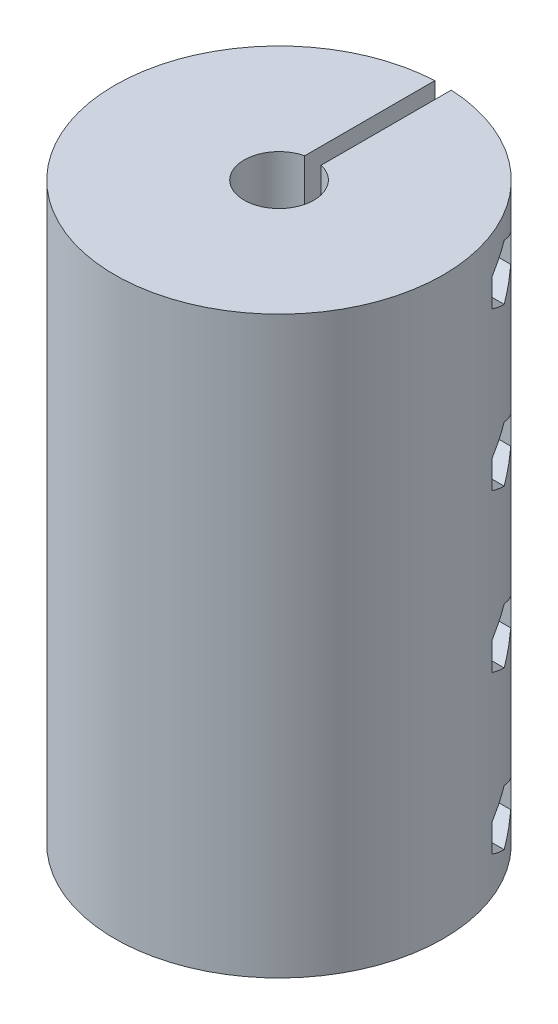
from build123d import *

# Parameters (mm, degrees)
SKETCH1_R           = 20
SKETCH1_R_2         = 4.25
BOSS_EXTRUDE1_DEPTH = 35
SKETCH2_W           = 2
SKETCH2_H           = 25
CUT_EXTRUDE1_DEPTH  = 35
SKETCH4_R           = 1.75
CUT_EXTRUDE2_DEPTH  = 30
CUT_EXTRUDE3_DEPTH  = 11
SKETCH6_R           = 3
CUT_EXTRUDE4_DEPTH  = 11


with BuildPart() as part:
    # Sketch1 → Boss-Extrude1 (new, symmetric)
    with BuildSketch(Plane(origin=(0, 0, 0), x_dir=(1, 0, 0), z_dir=(0, 1, 0))):
        with Locations(Location((0, 0, 0), (0, 0, 270))):
            Circle(SKETCH1_R)
        with Locations(Location((0, 0, 0), (0, 0, 270))):
            Circle(SKETCH1_R_2, mode=Mode.SUBTRACT)
    extrude(amount=BOSS_EXTRUDE1_DEPTH, both=True)

    # Sketch2 → Cut-Extrude1 (cut, symmetric)
    with BuildSketch(Plane(origin=(0, 0, 0), x_dir=(1, 0, 0), z_dir=(0, 1, 0))):
        with Locations((0, 12.5)):
            Rectangle(SKETCH2_W, SKETCH2_H)
    extrude(amount=CUT_EXTRUDE1_DEPTH, both=True, mode=Mode.SUBTRACT)

    # Sketch4 → Cut-Extrude2 (cut)
    with BuildSketch(Plane(origin=(20, 0, 0), x_dir=(0, 0, -1), z_dir=(1, 0, 0))):
        with Locations((10.231687805, 28.75)):
            Circle(SKETCH4_R)
        with Locations((10.231687805, 9.583333333)):
            Circle(SKETCH4_R)
        with Locations((10.231687805, -9.583333333)):
            Circle(SKETCH4_R)
        with Locations((10.231687805, -28.75)):
            Circle(SKETCH4_R)
    extrude(amount=-CUT_EXTRUDE2_DEPTH, mode=Mode.SUBTRACT)

    # Sketch5 → Cut-Extrude3 (cut)
    with BuildSketch(Plane(origin=(20, 0, 0), x_dir=(0, 0, -1), z_dir=(1, 0, 0))):
        Polygon((10.231687805, 32.127499075), (7.306687805, 30.438749537), (7.306687805, 27.061250463), (10.231687805, 25.372500925), (13.156687805, 27.061250463), (13.156687805, 30.438749537), align=None)
        Polygon((10.231687805, 6.205834259), (13.156687805, 7.894583796), (13.156687805, 11.272082871), (10.231687805, 12.960832408), (7.306687805, 11.272082871), (7.306687805, 7.894583796), align=None)
        Polygon((10.231687805, -12.960832408), (13.156687805, -11.272082871), (13.156687805, -7.894583796), (10.231687805, -6.205834259), (7.306687805, -7.894583796), (7.306687805, -11.272082871), align=None)
        Polygon((10.231687805, -32.127499075), (13.156687805, -30.438749537), (13.156687805, -27.061250463), (10.231687805, -25.372500925), (7.306687805, -27.061250463), (7.306687805, -30.438749537), align=None)
    extrude(amount=-CUT_EXTRUDE3_DEPTH, mode=Mode.SUBTRACT)

    # Sketch6 → Cut-Extrude4 (cut)
    with BuildSketch(Plane(origin=(-20, 0, 0), x_dir=(0, 0, -1), z_dir=(1, 0, 0))):
        with Locations(Location((10.231687805, 28.75, 0), (0, 0, 180))):
            Circle(SKETCH6_R)
        with Locations(Location((10.231687805, 9.583333333, 0), (0, 0, 180))):
            Circle(SKETCH6_R)
        with Locations(Location((10.231687805, -9.583333333, 0), (0, 0, 180))):
            Circle(SKETCH6_R)
        with Locations(Location((10.231687805, -28.75, 0), (0, 0, 180))):
            Circle(SKETCH6_R)
    extrude(amount=CUT_EXTRUDE4_DEPTH, mode=Mode.SUBTRACT)


solid = part.part
